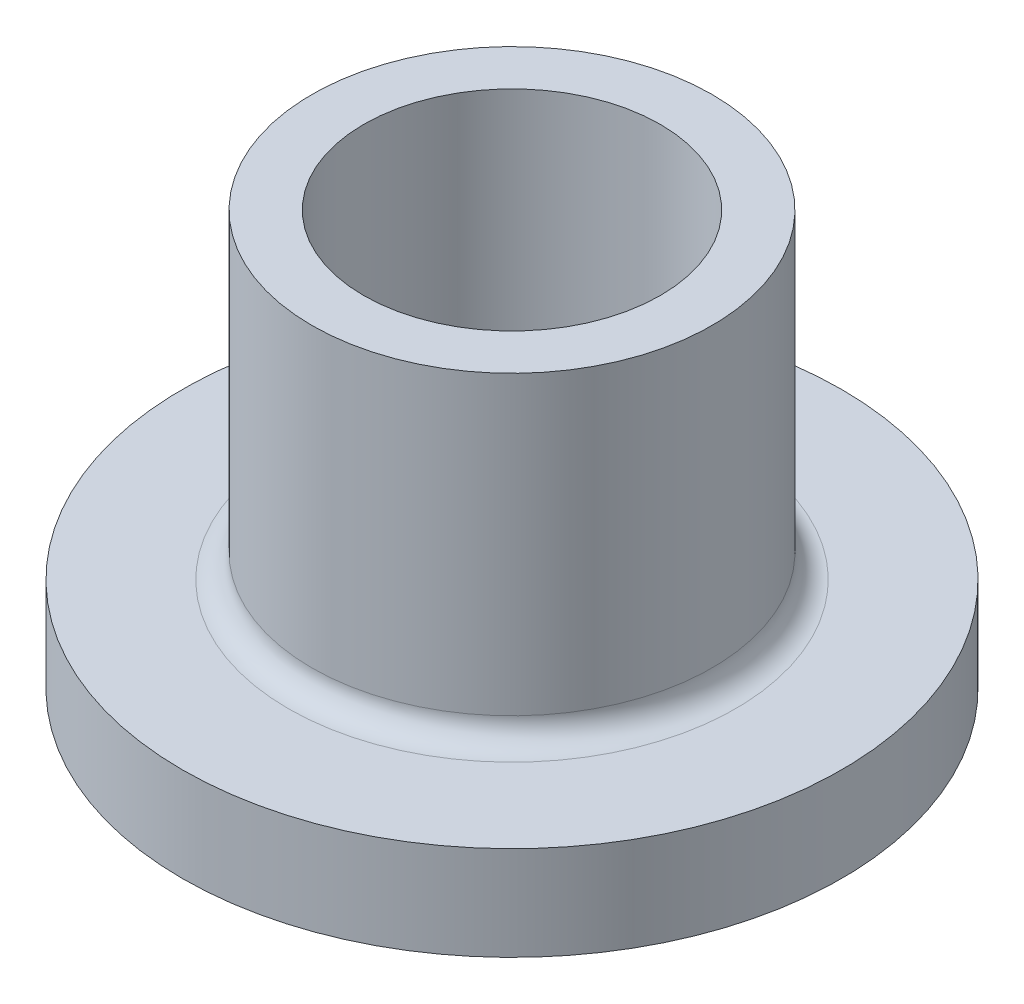
from build123d import *

# Parameters (mm, degrees)
SKETCH_1_R          = 7
EXTRUDE_1_DEPTH     = 2
SKETCH_2_R          = 4.25
EXTRUDE_2_DEPTH     = 6.8
CUT_EXTRUDE_1_REACH = 15.245
SKETCH_3_R          = 3.15
FILLET_1_R          = 0.5


with BuildPart() as part:
    # 草图1 → 凸台-拉伸1 (new body)
    with BuildSketch(Plane(origin=(0, 0, 0), x_dir=(1, 0, 0), z_dir=(0, 1, 0))):
        with Locations(Location((0, 0, 0), (0, 0, 270))):
            Circle(SKETCH_1_R)
    extrude(amount=EXTRUDE_1_DEPTH)

    # 草图2 → 凸台-拉伸2 (add)
    with BuildSketch(Plane(origin=(0, 2, 0), x_dir=(1, 0, 0), z_dir=(0, 1, 0))):
        with Locations(Location((0, 0, 0), (0, 0, 270))):
            Circle(SKETCH_2_R)
    extrude(amount=EXTRUDE_2_DEPTH)

    # 草图3 → 切除-拉伸1 (cut, up to next)
    with BuildSketch(Plane(origin=(0, 8.8, 0), x_dir=(1, 0, 0), z_dir=(0, 1, 0)), mode=Mode.PRIVATE) as cut_extrude_1_sk1:
        with Locations(Location((0, 0, 0), (0, 0, 270))):
            Circle(SKETCH_3_R)
    cut_extrude_1_tool1 = extrude(cut_extrude_1_sk1.sketch, amount=-CUT_EXTRUDE_1_REACH, mode=Mode.PRIVATE) & part.part
    add(cut_extrude_1_tool1.solids().sort_by_distance((0, 8.8, 0))[0], mode=Mode.SUBTRACT)

    # 圆角1
    fillet_1_edges = [part.edges().sort_by_distance(p)[0] for p in [
        (0, 2, -4.25),
    ]]
    fillet(fillet_1_edges, radius=FILLET_1_R)


solid = part.part
